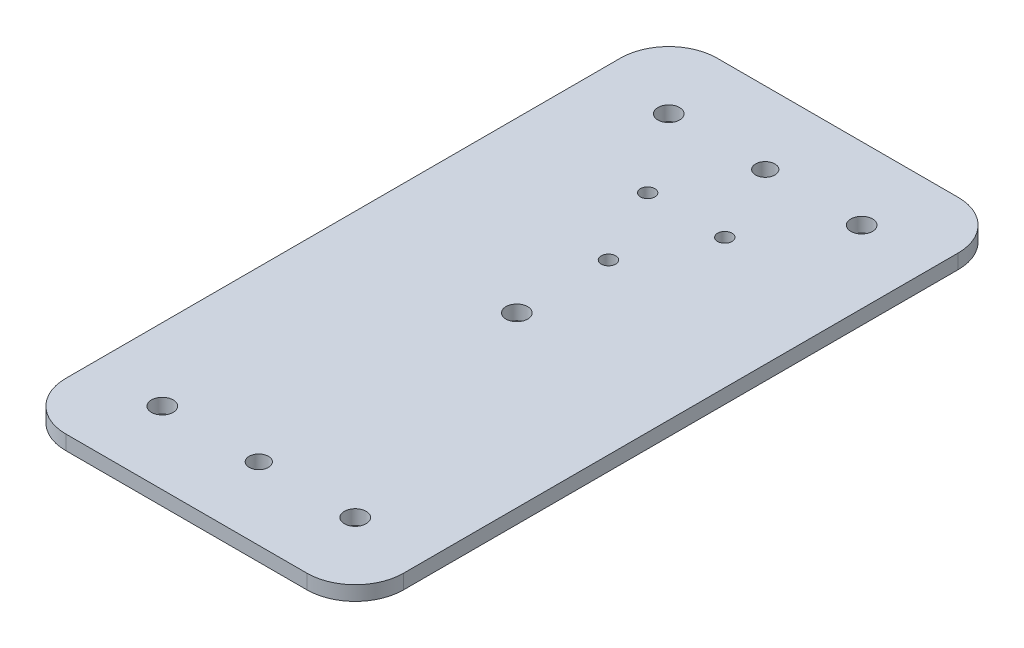
from build123d import *

# Parameters (mm, degrees)
SKETCH_1_W          = 70
SKETCH_1_H          = 135
EXTRUDE_1_DEPTH     = 3
SKETCH_2_R          = 2.25
SKETCH_2_R_2        = 2
CUT_EXTRUDE_1_DEPTH = 153.098652197
FILLET_1_R          = 10
SKETCH_3_R          = 1.5
SKETCH_3_R_2        = 2.25
CUT_EXTRUDE_2_DEPTH = 153.098652197


with BuildPart() as part:
    # 草图1 → 凸台-拉伸1 (new body)
    with BuildSketch(Plane(origin=(0, 0, 0), x_dir=(1, 0, 0), z_dir=(0, 1, 0))):
        with Locations((35, -67.5)):
            Rectangle(SKETCH_1_W, SKETCH_1_H)
    extrude(amount=EXTRUDE_1_DEPTH)

    # 草图2 → 切除-拉伸1 (cut, through all)
    with BuildSketch(Plane(origin=(0, 3, 0), x_dir=(1, 0, 0), z_dir=(0, 1, 0))):
        with Locations(Location((15, -15, 0), (0, 0, 270))):
            Circle(SKETCH_2_R)
        with Locations(Location((55, -15, 0), (0, 0, 270))):
            Circle(SKETCH_2_R)
        with Locations(Location((15, -120, 0), (0, 0, 270))):
            Circle(SKETCH_2_R)
        with Locations(Location((55, -120, 0), (0, 0, 270))):
            Circle(SKETCH_2_R)
        with Locations(Location((35, -120, 0), (0, 0, 270))):
            Circle(SKETCH_2_R_2)
        with Locations(Location((35, -15, 0), (0, 0, 270))):
            Circle(SKETCH_2_R_2)
    extrude(amount=-CUT_EXTRUDE_1_DEPTH, mode=Mode.SUBTRACT)

    # 圆角1
    fillet_1_edges = [part.edges().sort_by_distance(p)[0] for p in [
        (0, 1.5, 0),
        (70, 1.5, 0),
        (70, 1.5, 135),
        (0, 1.5, 135),
    ]]
    fillet(fillet_1_edges, radius=FILLET_1_R)

    # 草图3 → 切除-拉伸2 (cut, through all)
    with BuildSketch(Plane.XZ):
        with Locations(Location((35, 47.5, 0), (0, 0, 270))):
            Circle(SKETCH_3_R)
        with Locations(Location((43, 31.375484503, 0), (0, 0, 270))):
            Circle(SKETCH_3_R)
        with Locations(Location((27, 31.375484503, 0), (0, 0, 270))):
            Circle(SKETCH_3_R)
        with Locations(Location((35, 66.5, 0), (0, 0, 270))):
            Circle(SKETCH_3_R_2)
    extrude(amount=-CUT_EXTRUDE_2_DEPTH, mode=Mode.SUBTRACT)


solid = part.part
